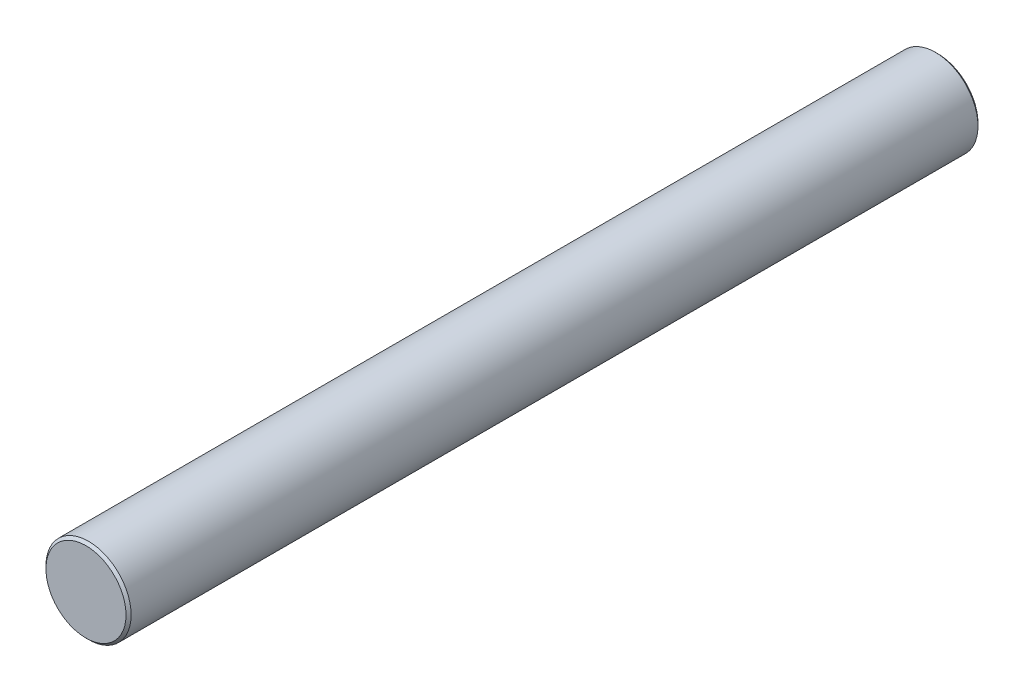
from build123d import *

# Parameters (mm, degrees)
SZKIC1_R                    = 5
DODANIE_WYCI_GNI_CIE1_DEPTH = 50
SFAZOWANIE1_SIZE            = 0.3


with BuildPart() as part:
    # Szkic1 → Dodanie-wyciągnięcie1 (new, symmetric)
    with BuildSketch(Plane.XY):
        Circle(SZKIC1_R)
    extrude(amount=DODANIE_WYCI_GNI_CIE1_DEPTH, both=True)

    # Sfazowanie1
    sfazowanie1_edges = [part.edges().sort_by_distance(p)[0] for p in [
        (-5, 0, -50),
        (-5, 0, 50),
    ]]
    chamfer(sfazowanie1_edges, length=SFAZOWANIE1_SIZE)


solid = part.part
